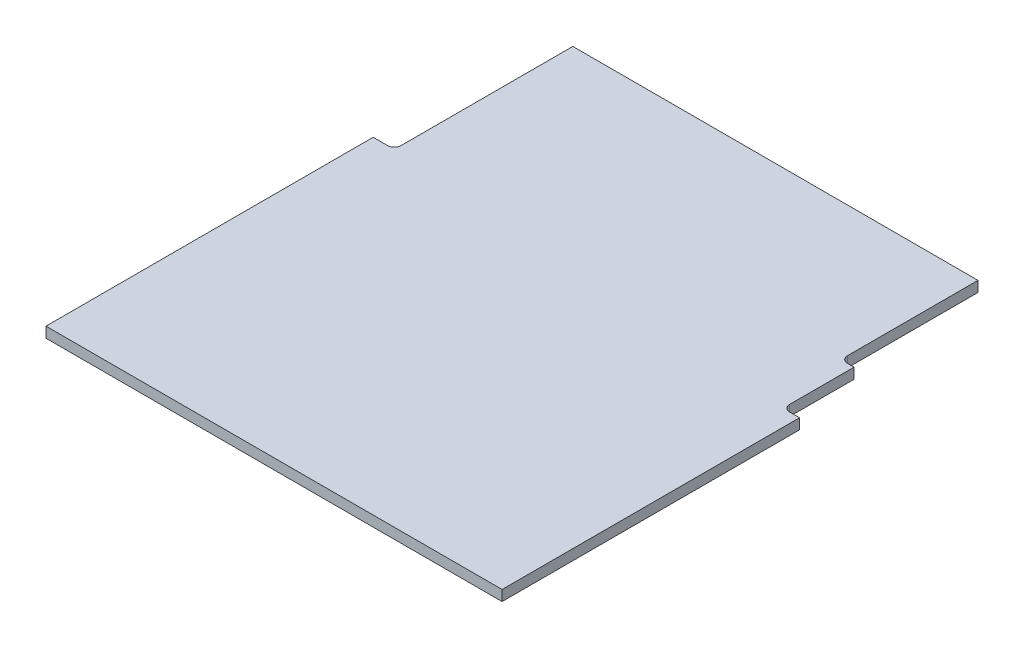
from build123d import *

# Parameters (mm, degrees)
FR4_DEPTH = 1.5875


with BuildPart() as part:
    # Sketch1 → FR4 (new body)
    with BuildSketch(Plane(origin=(0, 0, 0), x_dir=(1, 0, 0), z_dir=(0, 1, 0))):
        with BuildLine():
            Line((-34.5, -9), (34.5, -9))
            Line((34.5, -9), (34.5, 36))
            Line((34.5, 36), (32.940007652, 36))
            ThreePointArc((32.940007652, 36), (32.271894631, 36.313775841), (32, 37))
            Line((32, 37), (32, 46.75))
            Line((32, 46.75), (31, 46.75))
            ThreePointArc((31, 46.75), (30.292893219, 47.042893219), (30, 47.75))
            Line((30, 47.75), (30, 67.5))
            Line((30, 67.5), (-31.3, 67.5))
            Line((-31.3, 67.5), (-31.3, 41.5))
            ThreePointArc((-31.3, 41.5), (-31.564481186, 40.821086647), (-32.218527823, 40.5))
            Line((-32.218527823, 40.5), (-34.5, 40.5))
            Line((-34.5, 40.5), (-34.5, -9))
        make_face()
    extrude(amount=FR4_DEPTH)


solid = part.part
